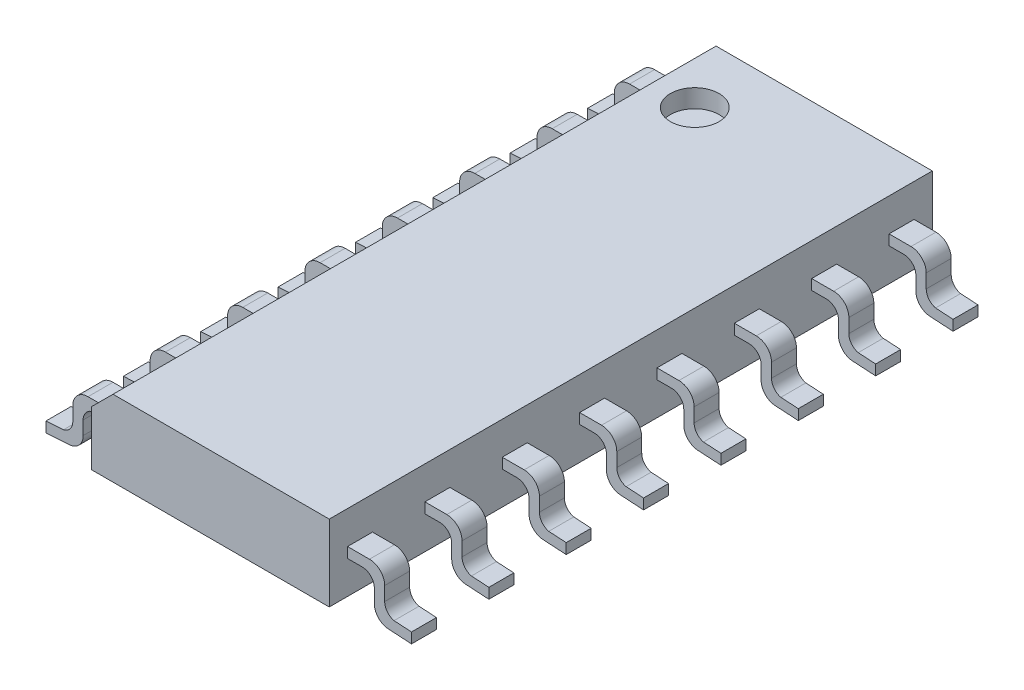
from build123d import *

# Parameters (mm, degrees)
SKETCH2_W            = 3.9
SKETCH2_H            = 9.9
BODY_DEPTH           = 1.25
LEAD_DEPTH           = 0.205
SD_LEADS_COUNT       = 8
SD_LEADS_PITCH       = 1.27
MIRROR1_COPY_1_DEPTH = 0.205
MIRROR1_COPY_2_DEPTH = 0.205
MIRROR1_COPY_3_DEPTH = 0.205
MIRROR1_COPY_4_DEPTH = 0.205
MIRROR1_COPY_5_DEPTH = 0.205
MIRROR1_COPY_6_DEPTH = 0.205
MIRROR1_COPY_7_DEPTH = 0.205
SKETCH4_R            = 0.4
CUT_EXTRUDE1_DEPTH   = 0.3
CHAMFER1_SIZE        = 0.35


with BuildPart() as part:
    # Sketch2 → Body (new body)
    with BuildSketch(Plane(origin=(0, 0.15, 0), x_dir=(1, 0, 0), z_dir=(0, 1, 0))):
        Rectangle(SKETCH2_W, SKETCH2_H)
    extrude(amount=BODY_DEPTH)

    # Sketch3 → Lead (add, symmetric)
    with BuildSketch(Plane.XY.offset(4.445)):
        with BuildLine():
            Line((1.95, 0.86), (2.310208153, 0.86))
            ThreePointArc((2.310208153, 0.86), (2.486837662, 0.786837662), (2.56, 0.610208153))
            Line((2.56, 0.610208153), (2.56, 0.382336704))
            ThreePointArc((2.56, 0.382336704), (2.602955115, 0.258494449), (2.713369039, 0.187848777))
            Line((2.713369039, 0.187848777), (3, 0.170317677))
            Line((3, 0.170317677), (3, 0))
            Line((3, 0), (2.619735905, 0.023257948))
            ThreePointArc((2.619735905, 0.023257948), (2.456460215, 0.099829069), (2.39, 0.267474908))
            Line((2.39, 0.267474908), (2.39, 0.49))
            ThreePointArc((2.39, 0.49), (2.331421356, 0.631421356), (2.19, 0.69))
            Line((2.19, 0.69), (1.95, 0.69))
            Line((1.95, 0.69), (1.95, 0.86))
        make_face()
    lead = extrude(amount=LEAD_DEPTH, both=True)

    # SD_Leads: Lead ×8
    with Locations(*[(0, 0, -i * SD_LEADS_PITCH) for i in range(1, SD_LEADS_COUNT)]):
        add(lead)

    # Mirror1: Lead across plane
    add(lead.mirror(Plane(origin=(0, 0, 0), x_dir=(0, 0, 1), z_dir=(1, 0, 0))))

    # Mirror1 copy 1 sketch → Mirror1 copy 1 (add, symmetric)
    with BuildSketch(Plane(origin=(0, 0, 3.175), x_dir=(-1, 0, 0), z_dir=(0, 0, 1))):
        with BuildLine():
            Line((1.95, -0.86), (2.310208153, -0.86))
            ThreePointArc((2.310208153, -0.86), (2.486837662, -0.786837662), (2.56, -0.610208153))
            Line((2.56, -0.610208153), (2.56, -0.382336704))
            ThreePointArc((2.56, -0.382336704), (2.602955115, -0.258494449), (2.713369039, -0.187848777))
            Line((2.713369039, -0.187848777), (3, -0.170317677))
            Line((3, -0.170317677), (3, 0))
            Line((3, 0), (2.619735905, -0.023257948))
            ThreePointArc((2.619735905, -0.023257948), (2.456460215, -0.099829069), (2.39, -0.267474908))
            Line((2.39, -0.267474908), (2.39, -0.49))
            ThreePointArc((2.39, -0.49), (2.331421356, -0.631421356), (2.19, -0.69))
            Line((2.19, -0.69), (1.95, -0.69))
            Line((1.95, -0.69), (1.95, -0.86))
        make_face()
    extrude(amount=MIRROR1_COPY_1_DEPTH, both=True)

    # Mirror1 copy 2 sketch → Mirror1 copy 2 (add, symmetric)
    with BuildSketch(Plane(origin=(0, 0, 1.905), x_dir=(-1, 0, 0), z_dir=(0, 0, 1))):
        with BuildLine():
            Line((1.95, -0.86), (2.310208153, -0.86))
            ThreePointArc((2.310208153, -0.86), (2.486837662, -0.786837662), (2.56, -0.610208153))
            Line((2.56, -0.610208153), (2.56, -0.382336704))
            ThreePointArc((2.56, -0.382336704), (2.602955115, -0.258494449), (2.713369039, -0.187848777))
            Line((2.713369039, -0.187848777), (3, -0.170317677))
            Line((3, -0.170317677), (3, 0))
            Line((3, 0), (2.619735905, -0.023257948))
            ThreePointArc((2.619735905, -0.023257948), (2.456460215, -0.099829069), (2.39, -0.267474908))
            Line((2.39, -0.267474908), (2.39, -0.49))
            ThreePointArc((2.39, -0.49), (2.331421356, -0.631421356), (2.19, -0.69))
            Line((2.19, -0.69), (1.95, -0.69))
            Line((1.95, -0.69), (1.95, -0.86))
        make_face()
    extrude(amount=MIRROR1_COPY_2_DEPTH, both=True)

    # Mirror1 copy 3 sketch → Mirror1 copy 3 (add, symmetric)
    with BuildSketch(Plane(origin=(0, 0, 0.635), x_dir=(-1, 0, 0), z_dir=(0, 0, 1))):
        with BuildLine():
            Line((1.95, -0.86), (2.310208153, -0.86))
            ThreePointArc((2.310208153, -0.86), (2.486837662, -0.786837662), (2.56, -0.610208153))
            Line((2.56, -0.610208153), (2.56, -0.382336704))
            ThreePointArc((2.56, -0.382336704), (2.602955115, -0.258494449), (2.713369039, -0.187848777))
            Line((2.713369039, -0.187848777), (3, -0.170317677))
            Line((3, -0.170317677), (3, 0))
            Line((3, 0), (2.619735905, -0.023257948))
            ThreePointArc((2.619735905, -0.023257948), (2.456460215, -0.099829069), (2.39, -0.267474908))
            Line((2.39, -0.267474908), (2.39, -0.49))
            ThreePointArc((2.39, -0.49), (2.331421356, -0.631421356), (2.19, -0.69))
            Line((2.19, -0.69), (1.95, -0.69))
            Line((1.95, -0.69), (1.95, -0.86))
        make_face()
    extrude(amount=MIRROR1_COPY_3_DEPTH, both=True)

    # Mirror1 copy 4 sketch → Mirror1 copy 4 (add, symmetric)
    with BuildSketch(Plane(origin=(0, 0, -0.635), x_dir=(-1, 0, 0), z_dir=(0, 0, 1))):
        with BuildLine():
            Line((1.95, -0.86), (2.310208153, -0.86))
            ThreePointArc((2.310208153, -0.86), (2.486837662, -0.786837662), (2.56, -0.610208153))
            Line((2.56, -0.610208153), (2.56, -0.382336704))
            ThreePointArc((2.56, -0.382336704), (2.602955115, -0.258494449), (2.713369039, -0.187848777))
            Line((2.713369039, -0.187848777), (3, -0.170317677))
            Line((3, -0.170317677), (3, 0))
            Line((3, 0), (2.619735905, -0.023257948))
            ThreePointArc((2.619735905, -0.023257948), (2.456460215, -0.099829069), (2.39, -0.267474908))
            Line((2.39, -0.267474908), (2.39, -0.49))
            ThreePointArc((2.39, -0.49), (2.331421356, -0.631421356), (2.19, -0.69))
            Line((2.19, -0.69), (1.95, -0.69))
            Line((1.95, -0.69), (1.95, -0.86))
        make_face()
    extrude(amount=MIRROR1_COPY_4_DEPTH, both=True)

    # Mirror1 copy 5 sketch → Mirror1 copy 5 (add, symmetric)
    with BuildSketch(Plane(origin=(0, 0, -1.905), x_dir=(-1, 0, 0), z_dir=(0, 0, 1))):
        with BuildLine():
            Line((1.95, -0.86), (2.310208153, -0.86))
            ThreePointArc((2.310208153, -0.86), (2.486837662, -0.786837662), (2.56, -0.610208153))
            Line((2.56, -0.610208153), (2.56, -0.382336704))
            ThreePointArc((2.56, -0.382336704), (2.602955115, -0.258494449), (2.713369039, -0.187848777))
            Line((2.713369039, -0.187848777), (3, -0.170317677))
            Line((3, -0.170317677), (3, 0))
            Line((3, 0), (2.619735905, -0.023257948))
            ThreePointArc((2.619735905, -0.023257948), (2.456460215, -0.099829069), (2.39, -0.267474908))
            Line((2.39, -0.267474908), (2.39, -0.49))
            ThreePointArc((2.39, -0.49), (2.331421356, -0.631421356), (2.19, -0.69))
            Line((2.19, -0.69), (1.95, -0.69))
            Line((1.95, -0.69), (1.95, -0.86))
        make_face()
    extrude(amount=MIRROR1_COPY_5_DEPTH, both=True)

    # Mirror1 copy 6 sketch → Mirror1 copy 6 (add, symmetric)
    with BuildSketch(Plane(origin=(0, 0, -3.175), x_dir=(-1, 0, 0), z_dir=(0, 0, 1))):
        with BuildLine():
            Line((1.95, -0.86), (2.310208153, -0.86))
            ThreePointArc((2.310208153, -0.86), (2.486837662, -0.786837662), (2.56, -0.610208153))
            Line((2.56, -0.610208153), (2.56, -0.382336704))
            ThreePointArc((2.56, -0.382336704), (2.602955115, -0.258494449), (2.713369039, -0.187848777))
            Line((2.713369039, -0.187848777), (3, -0.170317677))
            Line((3, -0.170317677), (3, 0))
            Line((3, 0), (2.619735905, -0.023257948))
            ThreePointArc((2.619735905, -0.023257948), (2.456460215, -0.099829069), (2.39, -0.267474908))
            Line((2.39, -0.267474908), (2.39, -0.49))
            ThreePointArc((2.39, -0.49), (2.331421356, -0.631421356), (2.19, -0.69))
            Line((2.19, -0.69), (1.95, -0.69))
            Line((1.95, -0.69), (1.95, -0.86))
        make_face()
    extrude(amount=MIRROR1_COPY_6_DEPTH, both=True)

    # Mirror1 copy 7 sketch → Mirror1 copy 7 (add, symmetric)
    with BuildSketch(Plane(origin=(0, 0, -4.445), x_dir=(-1, 0, 0), z_dir=(0, 0, 1))):
        with BuildLine():
            Line((1.95, -0.86), (2.310208153, -0.86))
            ThreePointArc((2.310208153, -0.86), (2.486837662, -0.786837662), (2.56, -0.610208153))
            Line((2.56, -0.610208153), (2.56, -0.382336704))
            ThreePointArc((2.56, -0.382336704), (2.602955115, -0.258494449), (2.713369039, -0.187848777))
            Line((2.713369039, -0.187848777), (3, -0.170317677))
            Line((3, -0.170317677), (3, 0))
            Line((3, 0), (2.619735905, -0.023257948))
            ThreePointArc((2.619735905, -0.023257948), (2.456460215, -0.099829069), (2.39, -0.267474908))
            Line((2.39, -0.267474908), (2.39, -0.49))
            ThreePointArc((2.39, -0.49), (2.331421356, -0.631421356), (2.19, -0.69))
            Line((2.19, -0.69), (1.95, -0.69))
            Line((1.95, -0.69), (1.95, -0.86))
        make_face()
    extrude(amount=MIRROR1_COPY_7_DEPTH, both=True)

    # Sketch4 → Cut-Extrude1 (cut)
    with BuildSketch(Plane(origin=(0, 1.4, 0), x_dir=(1, 0, 0), z_dir=(0, 1, 0))):
        with Locations(Location((-0.900802538, 3.900802538, 0), (0, 0, 270))):
            Circle(SKETCH4_R)
    extrude(amount=-CUT_EXTRUDE1_DEPTH, mode=Mode.SUBTRACT)

    # Chamfer1
    chamfer1_edges = [part.edges().sort_by_distance(p)[0] for p in [
        (-1.95, 1.4, 0),
    ]]
    chamfer(chamfer1_edges, length=CHAMFER1_SIZE)


solid = part.part
